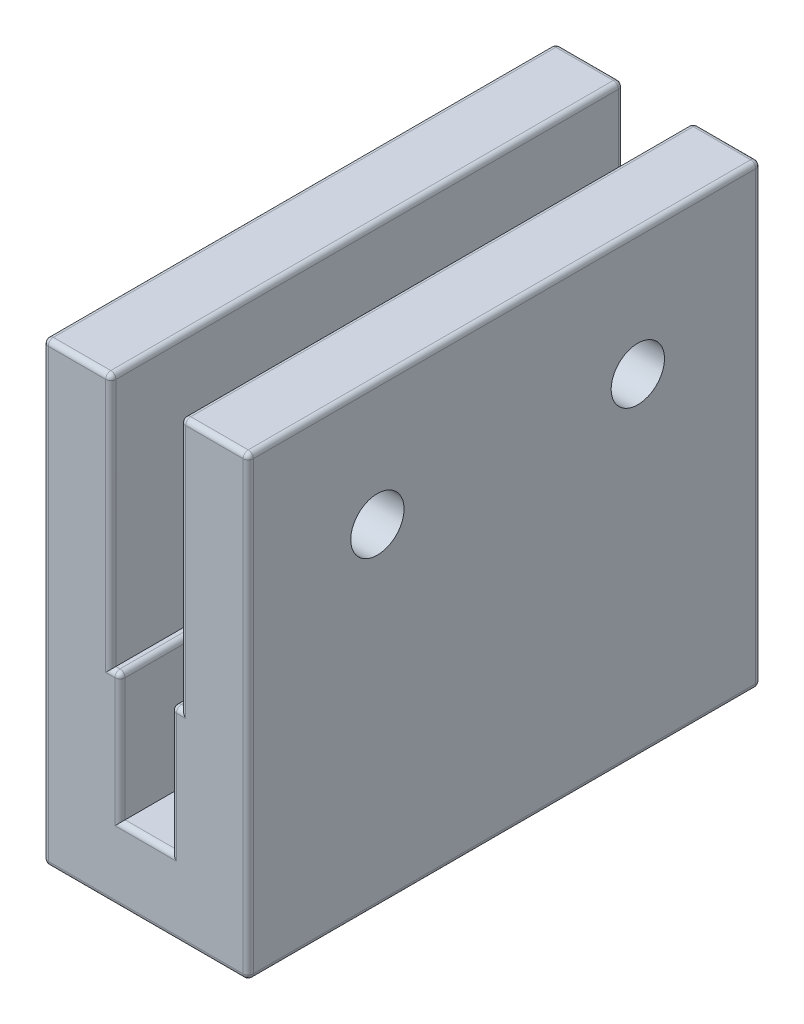
from build123d import *

# Parameters (mm, degrees)
SKETCH2_W               = 20
SKETCH2_H               = 50
BOSS_EXTRUDE1_DEPTH     = 44.5
SKETCH3_W               = 6.8
SKETCH3_H               = 24.75
SKETCH3_W_2             = 5
SKETCH3_H_2             = 12.5
CUT_EXTRUDE3_DEPTH      = 68.677544282
FILLET1_R               = 0.5
SKETCH7_W               = 4.6
SKETCH7_H               = 20.1
CUT_EXTRUDE4_DEPTH      = 3.25
CUT_EXTRUDE5_DEPTH      = 55.820160525
CUT_EXTRUDE5_DEPTH_BACK = 55.820160525
SKETCH8_R               = 2.6


with BuildPart() as part:
    # Sketch2 → Boss-Extrude1 (new body)
    with BuildSketch(Plane(origin=(0, 0, 0), x_dir=(1, 0, 0), z_dir=(0, 1, 0))):
        Rectangle(SKETCH2_W, SKETCH2_H)
    extrude(amount=BOSS_EXTRUDE1_DEPTH)

    # Sketch3 → Cut-Extrude3 (cut, through all)
    with BuildSketch(Plane.XY.offset(25)):
        with Locations((0, 32.125)):
            Rectangle(SKETCH3_W, SKETCH3_H)
        with Locations((0, 13.5)):
            Rectangle(SKETCH3_W_2, SKETCH3_H_2)
    extrude(amount=-CUT_EXTRUDE3_DEPTH, mode=Mode.SUBTRACT)

    # Fillet1
    fillet1_edges = [part.edges().sort_by_distance(p)[0] for p in [
        (-10, 44.5, 0),
        (-6.7, 44.5, -25),
        (6.7, 44.5, 25),
        (-6.7, 44.5, 25),
        (0, 7.25, -25),
        (-2.5, 13.5, 25),
        (2.5, 13.5, -25),
        (2.5, 19.75, 0),
        (-2.5, 13.5, -25),
        (3.4, 32.125, -25),
        (0, 7.25, 25),
        (2.5, 13.5, 25),
        (2.95, 19.75, 25),
        (-3.4, 32.125, 25),
        (-2.95, 19.75, 25),
        (-3.4, 44.5, 0),
        (3.4, 32.125, 25),
        (3.4, 44.5, 0),
        (-3.4, 32.125, -25),
        (-2.95, 19.75, -25),
        (-2.5, 19.75, 0),
        (2.95, 19.75, -25),
        (10, 44.5, 0),
        (0, 0, 25),
        (-10, 0, 0),
        (0, 0, -25),
        (10, 0, 0),
        (10, 22.25, 25),
        (-10, 22.25, 25),
        (-10, 22.25, -25),
        (10, 22.25, -25),
        (6.7, 44.5, -25),
    ]]
    fillet(fillet1_edges, radius=FILLET1_R)

    # Sketch7 → Cut-Extrude4 (cut)
    with BuildSketch(Plane.ZY.offset(10)):
        with Locations((16.3, 13.53)):
            Rectangle(SKETCH7_W, SKETCH7_H)
    extrude(amount=-CUT_EXTRUDE4_DEPTH, mode=Mode.SUBTRACT)

    # Sketch8 → Cut-Extrude5 (cut, two sides: drawn at the far end of the back side and taken through both)
    with BuildSketch(Plane.ZY.offset(10).offset(-CUT_EXTRUDE5_DEPTH_BACK)):
        with Locations((-13, 32.41)):
            Circle(SKETCH8_R)
        with Locations((12.4, 32.41)):
            Circle(SKETCH8_R)
    extrude(amount=CUT_EXTRUDE5_DEPTH + CUT_EXTRUDE5_DEPTH_BACK, mode=Mode.SUBTRACT)


solid = part.part
